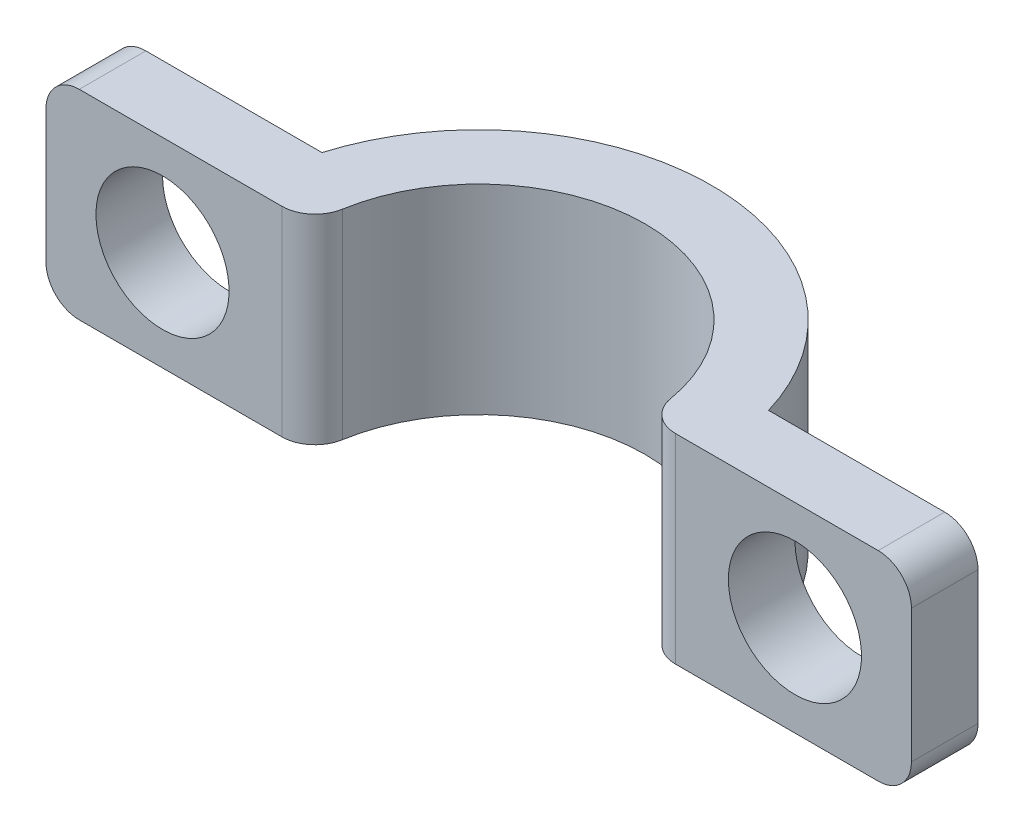
from build123d import *

# Parameters (mm, degrees)
BOSS_EXTRUDE1_DEPTH = 6
BOSS_EXTRUDE2_DEPTH = 6
SKETCH3_R           = 2
CUT_EXTRUDE1_DEPTH  = 6
FILLET1_R           = 1


with BuildPart() as part:
    # Sketch1 → Boss-Extrude1 (new body)
    with BuildSketch(Plane(origin=(0, 0, 0), x_dir=(1, 0, 0), z_dir=(0, 1, 0))):
        with BuildLine():
            Line((5, 0), (7, 0))
            ThreePointArc((7, 0), (0, 7), (-7, 0))
            Line((-7, 0), (-5, 0))
            ThreePointArc((-5, 0), (0, 5), (5, 0))
        make_face()
    extrude(amount=BOSS_EXTRUDE1_DEPTH)

    # Sketch2 → Boss-Extrude2 (add)
    with BuildSketch(Plane(origin=(0, 6, 0), x_dir=(1, 0, 0), z_dir=(0, 1, 0))):
        Polygon((7, 0), (13, 0), (13, 2), (6.708203932, 2), align=None)
        Polygon((-6.708203932, 2), (-7, 0), (-13, 0), (-13, 2), align=None)
    extrude(amount=-BOSS_EXTRUDE2_DEPTH)

    # Sketch3 → Cut-Extrude1 (cut)
    with BuildSketch(Plane(origin=(0, 0, -2), x_dir=(-1, 0, 0), z_dir=(0, 0, -1))):
        with Locations((-9.5, 3)):
            Circle(SKETCH3_R)
        with Locations((9.5, 3)):
            Circle(SKETCH3_R)
    extrude(amount=-CUT_EXTRUDE1_DEPTH, mode=Mode.SUBTRACT)

    # Fillet1
    fillet1_edges = [part.edges().sort_by_distance(p)[0] for p in [
        (13, 6, -1),
        (13, 0, -1),
        (-13, 6, -1),
        (-13, 0, -1),
        (-5, 3, 0),
        (5, 3, 0),
    ]]
    fillet(fillet1_edges, radius=FILLET1_R)


solid = part.part
